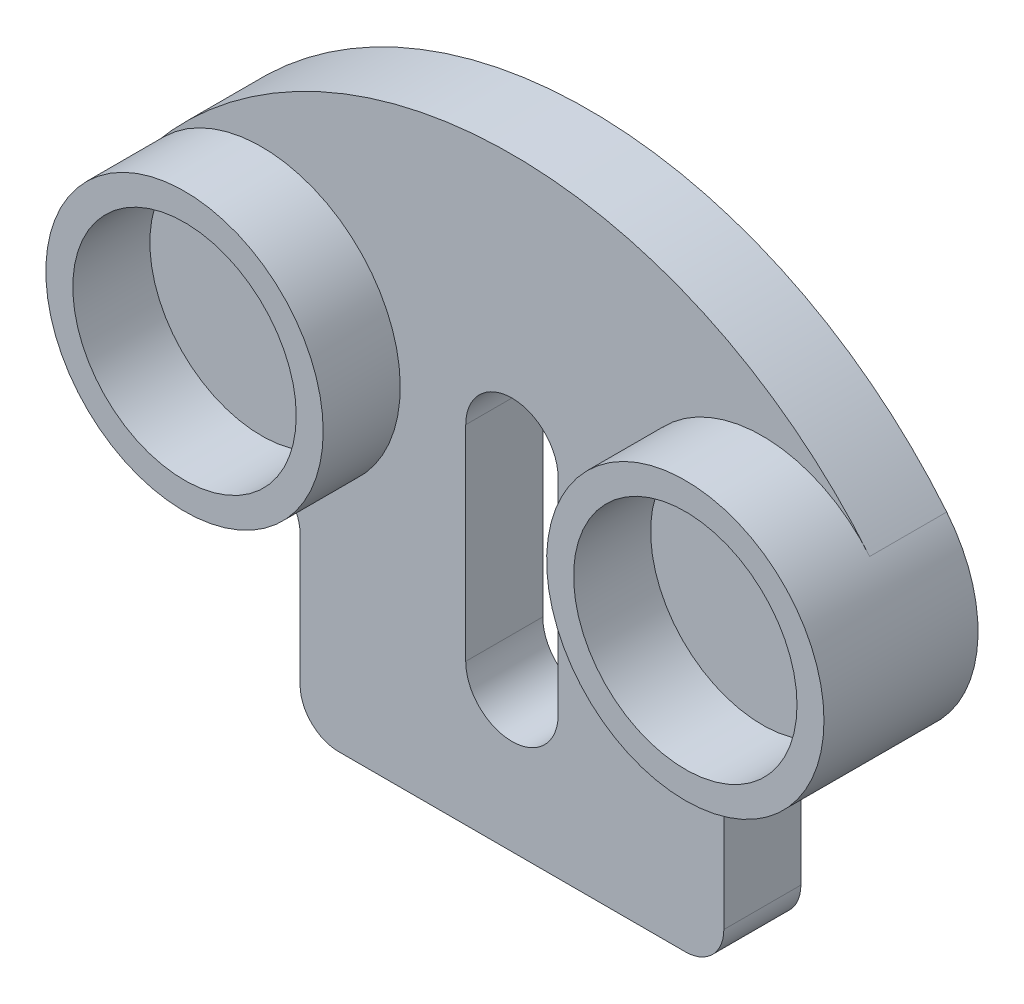
from build123d import *

# Parameters (mm, degrees)
SZKIC1_R                    = 18
SZKIC1_R_2                  = 13
DODANIE_WYCI_GNI_CIE5_DEPTH = 20
WYTNIJ_WYCI_GNI_CIE1_START  = -10
SZKIC3_R                    = 14.5
WYTNIJ_WYCI_GNI_CIE1_DEPTH  = 10


with BuildPart() as part:
    # Szkic1 → Dodanie-wyciągnięcie5 (new body)
    # profile 1 of 5: a face of its own
    with BuildSketch(Plane.XY):
        with BuildLine():
            ThreePointArc((-27.5, -13.396428811), (-26.035533906, -16.931962717), (-22.5, -18.396428811))
            Line((-22.5, -18.396428811), (22.5, -18.396428811))
            ThreePointArc((22.5, -18.396428811), (26.035533906, -16.931962717), (27.5, -13.396428811))
            Line((27.5, -13.396428811), (27.5, 3.603571189))
            ThreePointArc((27.5, 3.603571189), (28.964466094, 7.139105095), (32.5, 8.603571189))
            ThreePointArc((32.5, 8.603571189), (16.233046549, 34.309817059), (46.428571429, 38.005101698))
            ThreePointArc((46.428571429, 38.005101698), (0, 60), (-46.428571429, 38.005101698))
            ThreePointArc((-46.428571429, 38.005101698), (-26.446665618, 43.555182996), (-14.5, 26.603571189))
            ThreePointArc((-14.5, 26.603571189), (-19.772077939, 13.875649127), (-32.5, 8.603571189))
            ThreePointArc((-32.5, 8.603571189), (-28.964466094, 7.139105095), (-27.5, 3.603571189))
            Line((-27.5, 3.603571189), (-27.5, -13.396428811))
        make_face()
        with BuildLine():
            Line((-6, 0), (-6, 26.603571189))
            ThreePointArc((-6, 26.603571189), (0, 32.603571189), (6, 26.603571189))
            Line((6, 26.603571189), (6, 0))
            ThreePointArc((6, 0), (0, -6), (-6, 0))
        make_face(mode=Mode.SUBTRACT)
    # profile 2 of 5: a face of its own
    with BuildSketch(Plane.XY):
        with Locations((-32.5, 26.603571189)):
            Circle(SZKIC1_R)
        with Locations((-32.5, 26.603571189)):
            Circle(SZKIC1_R_2, mode=Mode.SUBTRACT)
    # profile 3 of 5: a face of its own
    with BuildSketch(Plane.XY):
        with Locations((32.5, 26.603571189)):
            Circle(SZKIC1_R)
        with Locations((32.5, 26.603571189)):
            Circle(SZKIC1_R_2, mode=Mode.SUBTRACT)
    # profile 4 of 5: a face of its own
    with BuildSketch(Plane.XY):
        with Locations((32.5, 26.603571189)):
            Circle(SZKIC1_R_2)
    # profile 5 of 5: a face of its own
    with BuildSketch(Plane.XY):
        with Locations((-32.5, 26.603571189)):
            Circle(SZKIC1_R_2)
    extrude(amount=DODANIE_WYCI_GNI_CIE5_DEPTH)

    # Szkic3 → Wytnij-wyciągnięcie1 (cut)
    # profile 1 of 3: a face of its own
    with BuildSketch(Plane.XY.offset(20).offset(WYTNIJ_WYCI_GNI_CIE1_START)):
        with BuildLine():
            ThreePointArc((-32.5, 8.603571189), (-28.964466094, 7.139105095), (-27.5, 3.603571189))
            Line((-27.5, 3.603571189), (-27.5, -13.396428811))
            ThreePointArc((-27.5, -13.396428811), (-26.035533906, -16.931962717), (-22.5, -18.396428811))
            Line((-22.5, -18.396428811), (22.5, -18.396428811))
            ThreePointArc((22.5, -18.396428811), (26.035533906, -16.931962717), (27.5, -13.396428811))
            Line((27.5, -13.396428811), (27.5, 3.603571189))
            ThreePointArc((27.5, 3.603571189), (28.964466094, 7.139105095), (32.5, 8.603571189))
            ThreePointArc((32.5, 8.603571189), (16.233046549, 34.309817059), (46.428571429, 38.005101698))
            ThreePointArc((46.428571429, 38.005101698), (0, 60), (-46.428571429, 38.005101698))
            ThreePointArc((-46.428571429, 38.005101698), (-26.446665618, 43.555182996), (-14.5, 26.603571189))
            ThreePointArc((-14.5, 26.603571189), (-19.772077939, 13.875649127), (-32.5, 8.603571189))
        make_face()
        with BuildLine():
            Line((-6, 0), (-6, 26.603571189))
            ThreePointArc((-6, 26.603571189), (0, 32.603571189), (6, 26.603571189))
            Line((6, 26.603571189), (6, 0))
            ThreePointArc((6, 0), (0, -6), (-6, 0))
        make_face(mode=Mode.SUBTRACT)
    # profile 2 of 3: a face of its own
    with BuildSketch(Plane.XY.offset(20).offset(WYTNIJ_WYCI_GNI_CIE1_START)):
        with Locations((-32.5, 26.603571189)):
            Circle(SZKIC3_R)
    # profile 3 of 3: a face of its own
    with BuildSketch(Plane.XY.offset(20).offset(WYTNIJ_WYCI_GNI_CIE1_START)):
        with Locations((32.5, 26.603571189)):
            Circle(SZKIC3_R)
    extrude(amount=WYTNIJ_WYCI_GNI_CIE1_DEPTH, mode=Mode.SUBTRACT)


solid = part.part
